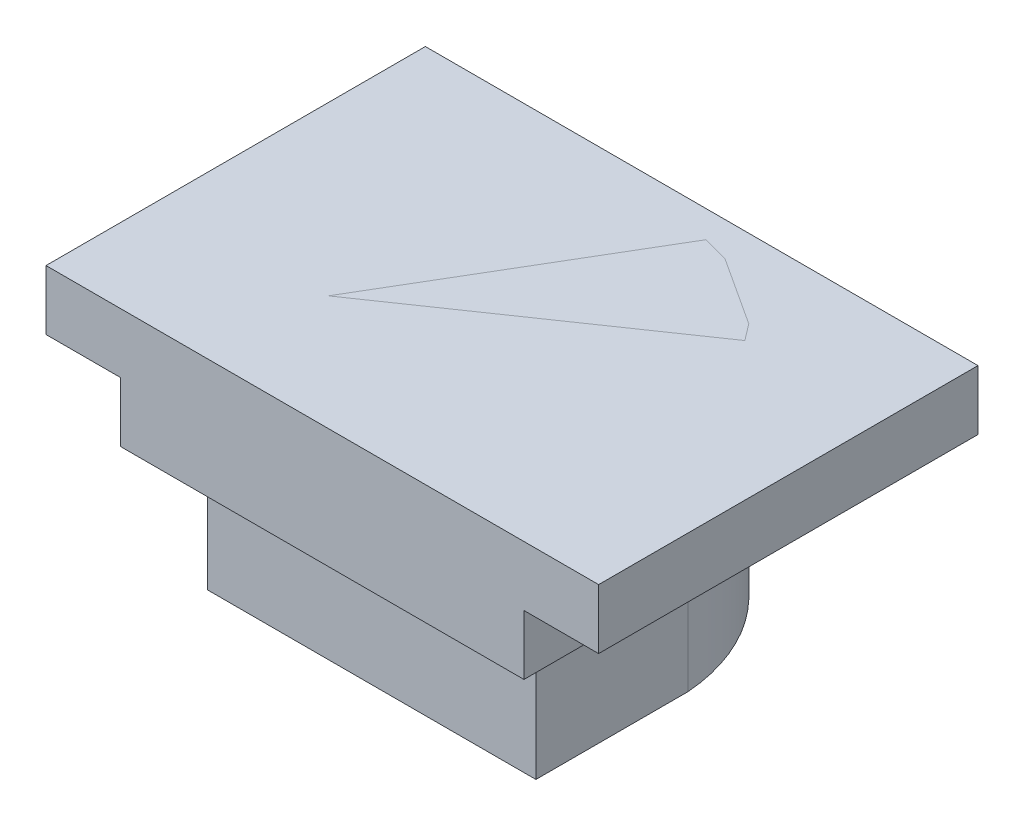
from build123d import *

# Parameters (mm, degrees)
BOSS_EXTRUDE2_DEPTH     = 2
BOSS_EXTRUDE3_DEPTH     = 1
SKETCH4_W               = 9.25
SKETCH4_H               = 6.35
BOSS_EXTRUDE4_DEPTH     = 1
BOSS_EXTRUDE6_DEPTH     = 3
BOSS_EXTRUDE7_DEPTH     = 5
CUT_EXTRUDE1_DEPTH      = 1
CUT_EXTRUDE1_DEPTH_BACK = 3


with BuildPart() as part:
    # Sketch2 → Boss-Extrude2 (new body)
    with BuildSketch(Plane(origin=(0, 0, 0), x_dir=(1, 0, 0), z_dir=(0, 1, 0))):
        with BuildLine():
            Line((-2.5, 5.5), (-5.6, 5.5))
            Line((-5.6, 5.5), (-5.6, 2.8))
            Line((-5.6, 2.8), (-5.6, 0.25))
            Line((-5.6, 0.25), (-0.1, 0.25))
            Line((-0.1, 0.25), (-0.1, 2.8))
            ThreePointArc((-0.1, 2.8), (-0.846230195, 4.553350938), (-2.5, 5.5))
        make_face()
    extrude(amount=BOSS_EXTRUDE2_DEPTH)

    # Sketch3 → Boss-Extrude3 (add)
    with BuildSketch(Plane.XZ):
        with BuildLine():
            Line((-6.4, 0.4), (0.35, 0.4))
            Line((0.35, 0.4), (0.35, -2.75))
            ThreePointArc((0.35, -2.75), (-0.518832832, -4.876682746), (-2.55, -5.95))
            Line((-2.55, -5.95), (-6.4, -5.95))
            Line((-6.4, -5.95), (-6.4, 0.4))
        make_face()
    extrude(amount=BOSS_EXTRUDE3_DEPTH)

    # Sketch4 → Boss-Extrude4 (add)
    with BuildSketch(Plane.XZ.offset(1)):
        with Locations((-3.025, -2.775)):
            Rectangle(SKETCH4_W, SKETCH4_H)
    extrude(amount=BOSS_EXTRUDE4_DEPTH)

    # Sketch3<3> → Boss-Extrude6 (add)
    with BuildSketch(Plane.XZ):
        with BuildLine():
            Line((-6.4, 0.4), (0.35, 0.4))
            Line((0.35, 0.4), (0.35, -2.75))
            ThreePointArc((0.35, -2.75), (-0.518832832, -4.876682746), (-2.55, -5.95))
            Line((-2.55, -5.95), (-6.4, -5.95))
            Line((-6.4, -5.95), (-6.4, 0.4))
        make_face()
    extrude(amount=BOSS_EXTRUDE6_DEPTH)


with BuildPart() as body_2:
    # Sketch2<5> → Boss-Extrude7 (new body)
    with BuildSketch(Plane(origin=(0, 0, 0), x_dir=(1, 0, 0), z_dir=(0, 1, 0))):
        with BuildLine():
            Line((-2.5, 5.5), (-5.6, 5.5))
            Line((-5.6, 5.5), (-5.6, 2.8))
            Line((-5.6, 2.8), (-5.6, 0.25))
            Line((-5.6, 0.25), (-0.1, 0.25))
            Line((-0.1, 0.25), (-0.1, 2.8))
            ThreePointArc((-0.1, 2.8), (-0.846230195, 4.553350938), (-2.5, 5.5))
        make_face()
    extrude(amount=-BOSS_EXTRUDE7_DEPTH)


with BuildPart() as cut_extrude1_tool:
    # Sketch3<4> → Cut-Extrude1 (new, two sides: drawn at the far end of the back side and taken through both)
    with BuildSketch(Plane.XZ.offset(-CUT_EXTRUDE1_DEPTH_BACK)):
        with BuildLine():
            Line((-6.4, 0.4), (0.35, 0.4))
            Line((0.35, 0.4), (0.35, -2.75))
            ThreePointArc((0.35, -2.75), (-0.518832832, -4.876682746), (-2.55, -5.95))
            Line((-2.55, -5.95), (-6.4, -5.95))
            Line((-6.4, -5.95), (-6.4, 0.4))
        make_face()
    extrude(amount=CUT_EXTRUDE1_DEPTH + CUT_EXTRUDE1_DEPTH_BACK)


with BuildPart() as part_1:
    add(part.part)

    # Cut-Extrude1: cut by cut_extrude1_tool
    add(cut_extrude1_tool.part, mode=Mode.SUBTRACT)


with BuildPart() as body_2_1:
    add(body_2.part)

    # Cut-Extrude1: cut by cut_extrude1_tool
    add(cut_extrude1_tool.part, mode=Mode.SUBTRACT)


solid = Compound([part_1.part, body_2_1.part])
